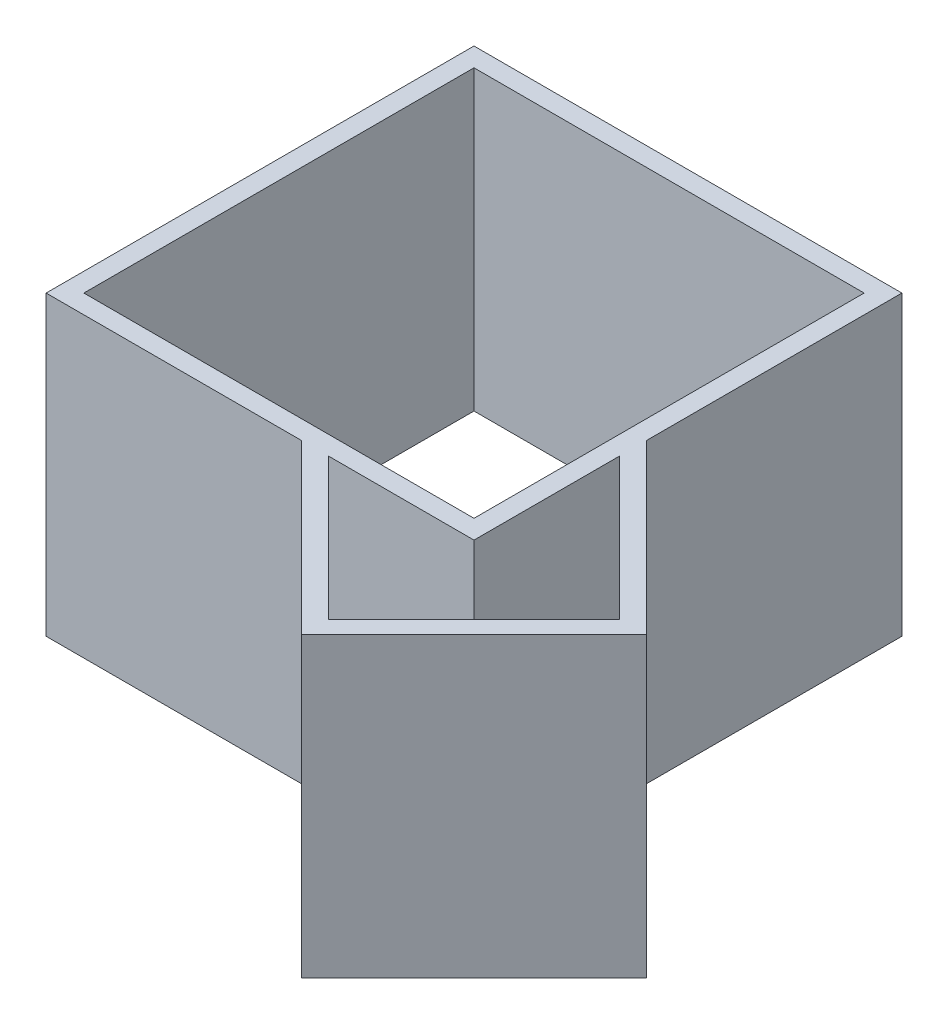
from build123d import *

# Parameters (mm, degrees)
SKETCH1_W           = 71.97
SKETCH1_H           = 71.97
SKETCH1_W_2         = 65.62
SKETCH1_H_2         = 65.62
BOSS_EXTRUDE1_DEPTH = 25
BOSS_EXTRUDE2_DEPTH = 25


with BuildPart() as part:
    # Sketch1 → Boss-Extrude1 (new, symmetric)
    with BuildSketch(Plane(origin=(0, 0, 0), x_dir=(1, 0, 0), z_dir=(0, 1, 0))):
        Rectangle(SKETCH1_W, SKETCH1_H)
        Rectangle(SKETCH1_W_2, SKETCH1_H_2, mode=Mode.SUBTRACT)
    extrude(amount=BOSS_EXTRUDE1_DEPTH, both=True)

    # Sketch2 → Boss-Extrude2 (add, symmetric)
    with BuildSketch(Plane(origin=(0, 0, 0), x_dir=(1, 0, 0), z_dir=(0, 1, 0))):
        Polygon((35.277893219, -64.269271247), (6.993621971, -35.985), (11.483750032, -35.985), (35.277893219, -59.779143187), (59.779143187, -35.277893219), (35.985, -11.483750032), (35.985, -6.993621971), (64.269271247, -35.277893219), align=None)
    extrude(amount=BOSS_EXTRUDE2_DEPTH, both=True)


solid = part.part
